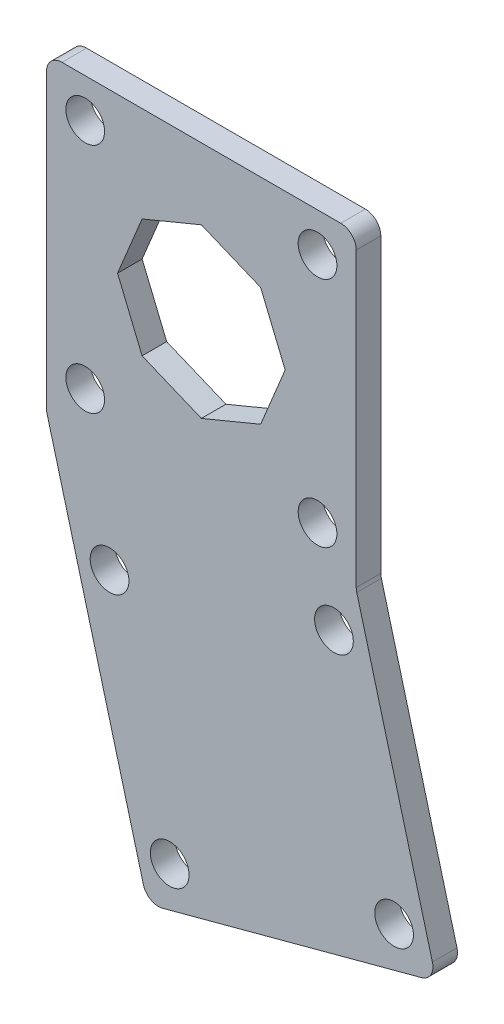
from build123d import *

# Parameters (mm, degrees)
SKETCH1_R           = 2.5
BOSS_EXTRUDE1_DEPTH = 3.175
FILLET1_R           = 2


with BuildPart() as part:
    # Sketch1 → Boss-Extrude1 (new body)
    with BuildSketch(Plane.XY):
        Polygon((-20, 20), (20, 20), (20, -20), (30.352761804, -58.637033052), (-6.967746272, -68.637033052), (-20, -20), align=None)
        with Locations((-15, 15)):
            Circle(SKETCH1_R, mode=Mode.SUBTRACT)
        with Locations((-15, -15)):
            Circle(SKETCH1_R, mode=Mode.SUBTRACT)
        with Locations((15, 15)):
            Circle(SKETCH1_R, mode=Mode.SUBTRACT)
        with Locations((15, -15)):
            Circle(SKETCH1_R, mode=Mode.SUBTRACT)
        with Locations((-11.855046207, -33.711914808)):
            Circle(SKETCH1_R, mode=Mode.SUBTRACT)
        with Locations((17.122728582, -25.947343455)):
            Circle(SKETCH1_R, mode=Mode.SUBTRACT)
        with Locations((24.887299935, -54.925118244)):
            Circle(SKETCH1_R, mode=Mode.SUBTRACT)
        with Locations((-4.090474854, -62.689689597)):
            Circle(SKETCH1_R, mode=Mode.SUBTRACT)
        Polygon((10.823922003, 0), (7.653668647, 7.653668647), (0, 10.823922003), (-7.653668647, 7.653668647), (-10.823922003, 0), (-7.653668647, -7.653668647), (0, -10.823922003), (7.653668647, -7.653668647), align=None, mode=Mode.SUBTRACT)
    extrude(amount=BOSS_EXTRUDE1_DEPTH)

    # Fillet1
    fillet1_edges = [part.edges().sort_by_distance(p)[0] for p in [
        (-20, 20, 1.5875),
        (20, 20, 1.5875),
        (20, -20, 1.5875),
        (30.352761804, -58.637033052, 1.5875),
        (-6.967746272, -68.637033052, 1.5875),
        (-20, -20, 1.5875),
    ]]
    fillet(fillet1_edges, radius=FILLET1_R)


solid = part.part
